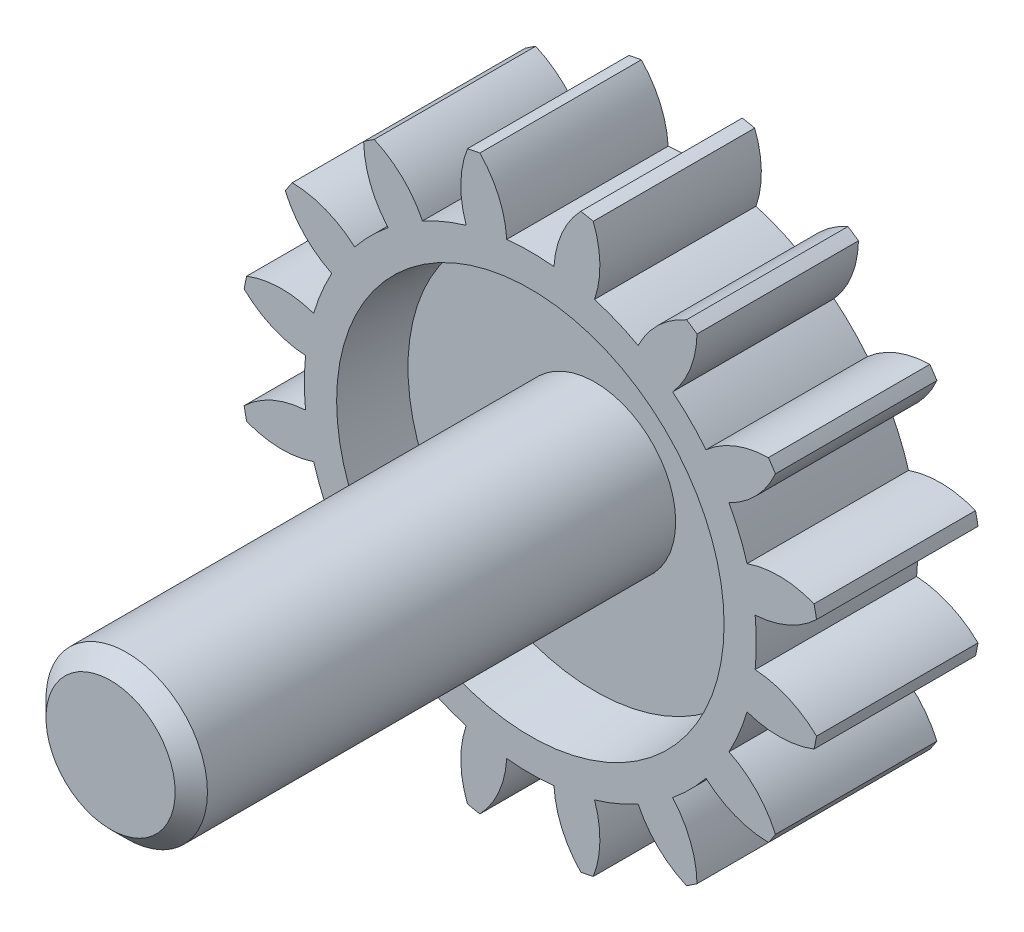
from build123d import *

# Parameters (mm, degrees)
SKETCH_1_R               = 18
EXTRUDE_1_DEPTH          = 10
CUT_EXTRUDE_1_DEPTH      = 28.349588662
PATTERN_CIRCULAR_1_COUNT = 16
SKETCH_3_R               = 12
CUT_EXTRUDE_2_DEPTH      = 4
CUT_EXTRUDE_2_DRAFT      = -6
CUT_EXTRUDE_START        = -10
SKETCH_3_2_R             = 12
CUT_EXTRUDE_3_DEPTH      = 4
CUT_EXTRUDE_3_TAPER      = 6
SKETCH_5_R               = 5
EXTRUDE_2_DEPTH          = 30
CHAMFER_1_SIZE           = 1


with BuildPart() as part:
    # Эскиз1 → Бобышка-Вытянуть1 (new body)
    with BuildSketch(Plane.XY):
        Circle(SKETCH_1_R)
    extrude(amount=-EXTRUDE_1_DEPTH)

    # Эскиз2 → Вырез-Вытянуть1 (cut, through all)
    with BuildSketch(Plane.XY):
        with BuildLine():
            ThreePointArc((3.125667198, 17.726539554), (0, 18), (-3.125667198, 17.726539554))
            ThreePointArc((-3.125667198, 17.726539554), (-1.955189123, 15.973239081), (-1.463398486, 13.923306535))
            ThreePointArc((-1.463398486, 13.923306535), (0, 14), (1.463398486, 13.923306535))
            ThreePointArc((1.463398486, 13.923306535), (1.955189123, 15.973239081), (3.125667198, 17.726539554))
        make_face()
    cut_extrude_1 = extrude(amount=-CUT_EXTRUDE_1_DEPTH, mode=Mode.SUBTRACT)

    # Круговой массив1: Вырез-Вытянуть1 ×16 about axis
    pattern_circular_1_axis = Axis((0, 0, 0), (0, 0, 1))
    for i in range(1, PATTERN_CIRCULAR_1_COUNT):
        add(cut_extrude_1.rotate(pattern_circular_1_axis, i * 360 / PATTERN_CIRCULAR_1_COUNT), mode=Mode.SUBTRACT)


with BuildPart() as cut_extrude_2_tool:
    # Эскиз3 → Вырез-Вытянуть2 (with draft: the straight prism first)
    with BuildSketch(Plane.XY):
        Circle(SKETCH_3_R)
    extrude(amount=-CUT_EXTRUDE_2_DEPTH)
    # Вырез-Вытянуть2: the draft: its side faces are tilted about the plane it starts from
    cut_extrude_2_sides = [cut_extrude_2_tool.faces().sort_by_distance(p)[0] for p in [
        (-12, 0, -2),
    ]]
    draft(cut_extrude_2_sides, Plane.XY, CUT_EXTRUDE_2_DRAFT)


with BuildPart() as part_1:
    add(part.part)

    # Вырез-Вытянуть2: cut by cut_extrude_2_tool
    add(cut_extrude_2_tool.part, mode=Mode.SUBTRACT)

    # Эскиз3<2> → Вырез-Вытянуть3 (cut)
    with BuildSketch(Plane.XY.offset(CUT_EXTRUDE_START)):
        Circle(SKETCH_3_2_R)
    extrude(amount=CUT_EXTRUDE_3_DEPTH, taper=CUT_EXTRUDE_3_TAPER, mode=Mode.SUBTRACT)

    # Эскиз5 → Бобышка-Вытянуть2 (add)
    with BuildSketch(Plane.XY.offset(-4)):
        Circle(SKETCH_5_R)
    extrude(amount=EXTRUDE_2_DEPTH)

    # Фаска1
    chamfer_1_edges = [part_1.edges().sort_by_distance(p)[0] for p in [
        (-5, 0, 26),
    ]]
    chamfer(chamfer_1_edges, length=CHAMFER_1_SIZE)


solid = part_1.part
